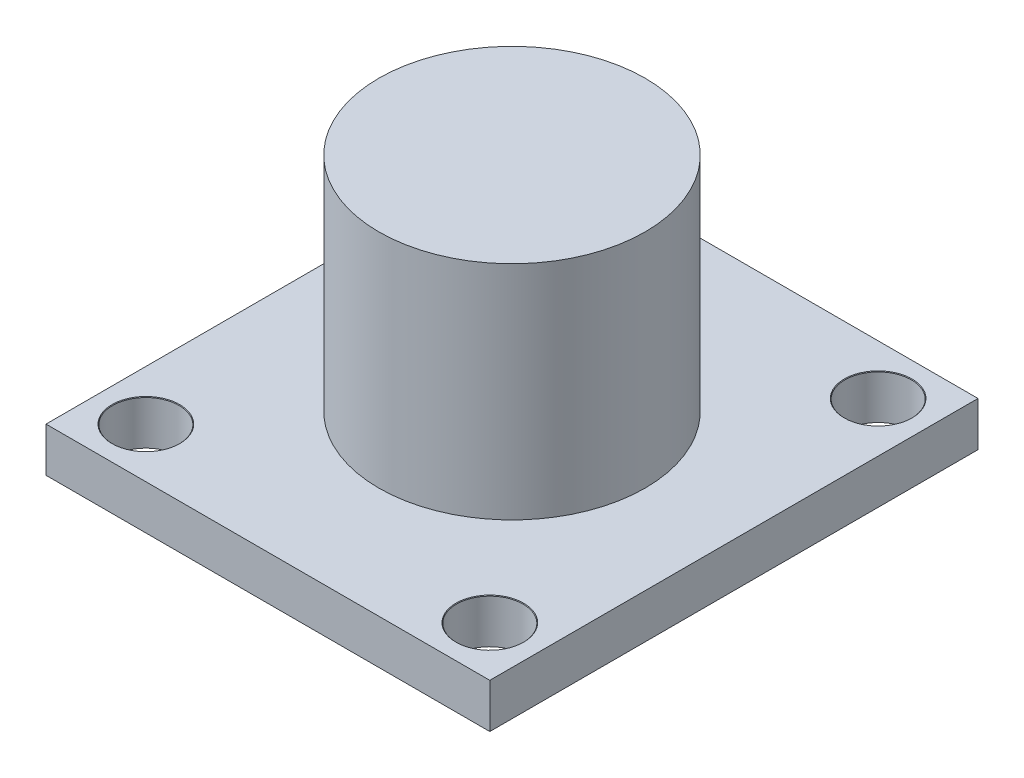
from build123d import *

# Parameters (mm, degrees)
SKETCH1_W                          = 20
SKETCH1_H                          = 22
BOSS_EXTRUDE1_DEPTH                = 2
F_3_0_3_DIAMETER_HOLE1_D           = 3
F_3_0_3_DIAMETER_HOLE1_CSINK_D     = 3.05
F_3_0_3_DIAMETER_HOLE1_CSINK_ANGLE = 90
SKETCH4_R                          = 6
BOSS_EXTRUDE2_DEPTH                = 10


with BuildPart() as part:
    # Sketch1 → Boss-Extrude1 (new body)
    with BuildSketch(Plane(origin=(0, 0, 0), x_dir=(1, 0, 0), z_dir=(0, 1, 0))):
        Rectangle(SKETCH1_W, SKETCH1_H)
    extrude(amount=BOSS_EXTRUDE1_DEPTH)

    # Ø3.0 (3) Diameter Hole1 (through all)
    with Locations(Plane(origin=(0, 2, 0), x_dir=(1, 0, 0), z_dir=(0, 1, 0))):
        with Locations((-7.75, 8.75), (7.75, -8.75), (-7.75, -8.75), (7.75, 8.75)):
            CounterSinkHole(F_3_0_3_DIAMETER_HOLE1_D / 2, F_3_0_3_DIAMETER_HOLE1_CSINK_D / 2, counter_sink_angle=F_3_0_3_DIAMETER_HOLE1_CSINK_ANGLE)

    # Sketch4 → Boss-Extrude2 (add)
    with BuildSketch(Plane(origin=(0, 2, 0), x_dir=(1, 0, 0), z_dir=(0, 1, 0))):
        with Locations(Location((0, 0, 0), (0, 0, 270))):
            Circle(SKETCH4_R)
    extrude(amount=BOSS_EXTRUDE2_DEPTH)


solid = part.part
